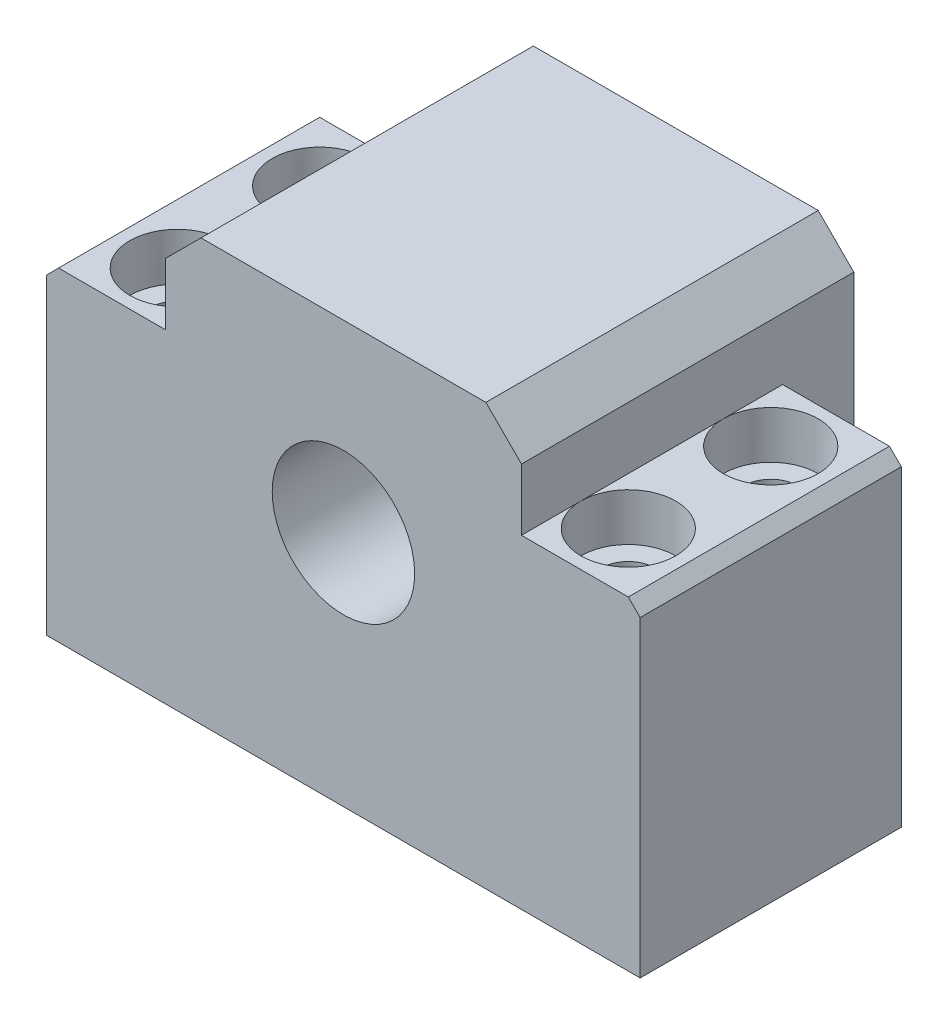
from build123d import *

# Parameters (mm, degrees)
SKETCH_1_W                   = 50
SKETCH_1_H                   = 27.3
EXTRUDE_1_DEPTH              = 22
SKETCH_2_W                   = 30
SKETCH_2_H                   = 30
EXTRUDE_2_DEPTH              = 28
SKETCH_3_R                   = 6
CUT_EXTRUDE_1_DEPTH          = 68.411052506
CHAMFER_1_SIZE               = 3
CHAMFER_2_SIZE               = 1
HOLE_WIZARD_M4_1_D           = 4.5
HOLE_WIZARD_M4_1_CBORE_D     = 8
HOLE_WIZARD_M4_1_CBORE_DEPTH = 4


with BuildPart() as part:
    # 스케치1 → 보스-돌출1 (new body)
    with BuildSketch(Plane.XY):
        with Locations((25, 13.65)):
            Rectangle(SKETCH_1_W, SKETCH_1_H)
    extrude(amount=EXTRUDE_1_DEPTH)

    # 스케치2 → 보스-돌출2 (add)
    with BuildSketch(Plane.XY.offset(22)):
        with Locations((25, 20.5)):
            Rectangle(SKETCH_2_W, SKETCH_2_H)
    extrude(amount=-EXTRUDE_2_DEPTH)

    # 스케치3 → 컷-돌출1 (cut, through all)
    with BuildSketch(Plane(origin=(0, 0, -6), x_dir=(-1, 0, 0), z_dir=(0, 0, -1))):
        with Locations((-25, 20)):
            Circle(SKETCH_3_R)
    extrude(amount=-CUT_EXTRUDE_1_DEPTH, mode=Mode.SUBTRACT)

    # 모따기1
    chamfer_1_edges = [part.edges().sort_by_distance(p)[0] for p in [
        (40, 35.5, 8),
        (10, 35.5, 8),
    ]]
    chamfer(chamfer_1_edges, length=CHAMFER_1_SIZE)

    # 모따기2
    chamfer_2_edges = [part.edges().sort_by_distance(p)[0] for p in [
        (0, 27.3, 11),
        (50, 27.3, 11),
    ]]
    chamfer(chamfer_2_edges, length=CHAMFER_2_SIZE)

    # M4 소켓 머리 캡 나사용 카운터보어1 (through all)
    with Locations(Plane(origin=(0, 27.3, 0), x_dir=(1, 0, 0), z_dir=(0, 1, 0))):
        with Locations((44, -5), (44, -17), (6, -17), (6, -5)):
            CounterBoreHole(HOLE_WIZARD_M4_1_D / 2, HOLE_WIZARD_M4_1_CBORE_D / 2, HOLE_WIZARD_M4_1_CBORE_DEPTH)


solid = part.part
